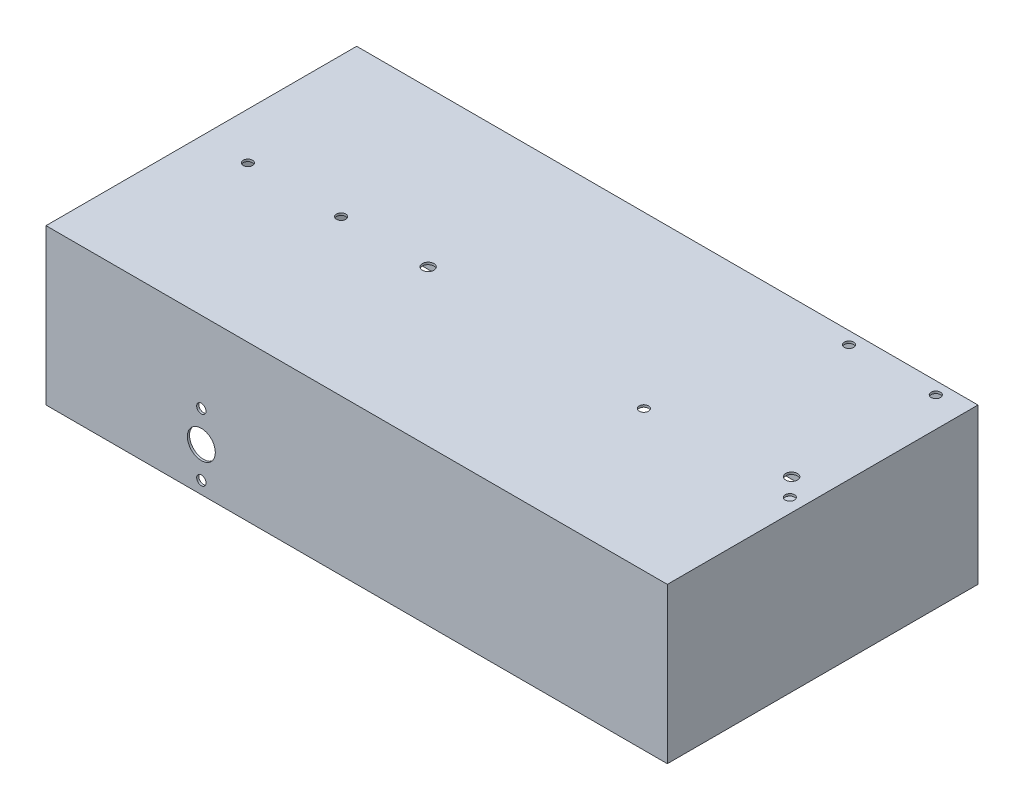
from build123d import *

# Parameters (mm, degrees)
SKETCH1_W           = 200
SKETCH1_H           = 100
BOSS_EXTRUDE1_DEPTH = 50
SKETCH3_W           = 198.6
SKETCH3_H           = 98.6
CUT_EXTRUDE1_DEPTH  = 49.3
SKETCH4_W           = 54.3
SKETCH4_H           = 98.6
BOSS_EXTRUDE2_DEPTH = 0.7
SKETCH2_R           = 4.5
SKETCH2_R_2         = 1.5
CUT_EXTRUDE2_DEPTH  = 230.128784748
SKETCH8_R           = 1.21
CUT_EXTRUDE6_DEPTH  = 1.8
SKETCH10_R          = 1.87
CUT_EXTRUDE8_DEPTH  = 0.7
SKETCH9_R           = 1.5
CUT_EXTRUDE7_DEPTH  = 213.132034356
SKETCH11_R          = 1.5
CUT_EXTRUDE9_DEPTH  = 0.7


with BuildPart() as part:
    # Sketch1 → Boss-Extrude1 (new body)
    with BuildSketch(Plane(origin=(0, 0, 0), x_dir=(1, 0, 0), z_dir=(0, 1, 0))):
        with Locations((100, 0)):
            Rectangle(SKETCH1_W, SKETCH1_H)
    extrude(amount=BOSS_EXTRUDE1_DEPTH)

    # Sketch3 → Cut-Extrude1 (cut)
    with BuildSketch(Plane.XZ):
        with Locations((100, 0)):
            Rectangle(SKETCH3_W, SKETCH3_H)
    extrude(amount=-CUT_EXTRUDE1_DEPTH, mode=Mode.SUBTRACT)

    # Sketch4 → Boss-Extrude2 (add)
    with BuildSketch(Plane.XZ):
        with Locations((172.15, 0)):
            Rectangle(SKETCH4_W, SKETCH4_H)
    extrude(amount=-BOSS_EXTRUDE2_DEPTH)

    # Sketch2 → Cut-Extrude2 (cut, through all)
    with BuildSketch(Plane.XY.offset(50)):
        with Locations((50, 14)):
            Circle(SKETCH2_R)
        with Locations((50, 4)):
            Circle(SKETCH2_R_2)
        with Locations((50, 24)):
            Circle(SKETCH2_R_2)
    extrude(amount=-CUT_EXTRUDE2_DEPTH, mode=Mode.SUBTRACT)

    # Sketch8 → Cut-Extrude6 (cut)
    with BuildSketch(Plane.XZ):
        with Locations(Location((160, 8.45, 0), (0, 0, 270))):
            Circle(SKETCH8_R)
        with Locations(Location((160, -7.05, 0), (0, 0, 270))):
            Circle(SKETCH8_R)
    extrude(amount=-CUT_EXTRUDE6_DEPTH, mode=Mode.SUBTRACT)

    # Sketch10 → Cut-Extrude8 (cut)
    with BuildSketch(Plane.XZ.offset(-49.3)):
        with Locations(Location((190, 0, 0), (0, 0, 270))):
            Circle(SKETCH10_R)
        with Locations(Location((73, 0, 0), (0, 0, 270))):
            Circle(SKETCH10_R)
    extrude(amount=-CUT_EXTRUDE8_DEPTH, mode=Mode.SUBTRACT)

    # Sketch9 → Cut-Extrude7 (cut, through all)
    with BuildSketch(Plane(origin=(0, 50, 0), x_dir=(1, 0, 0), z_dir=(0, 1, 0))):
        with Locations(Location((15, 0, 0), (0, 0, 270))):
            Circle(SKETCH9_R)
        with Locations(Location((45, 0, 0), (0, 0, 270))):
            Circle(SKETCH9_R)
    extrude(amount=-CUT_EXTRUDE7_DEPTH, mode=Mode.SUBTRACT)

    # Sketch11 → Cut-Extrude9 (cut)
    with BuildSketch(Plane(origin=(143.38, 50, -175.08), x_dir=(0, 0, 1), z_dir=(0, 1, 0))):
        with Locations((129.04, 47)):
            Circle(SKETCH11_R)
        with Locations((181.11, 52.08)):
            Circle(SKETCH11_R)
        with Locations((179.84, 3.82)):
            Circle(SKETCH11_R)
        with Locations((129.04, 19.06)):
            Circle(SKETCH11_R)
    extrude(amount=-CUT_EXTRUDE9_DEPTH, mode=Mode.SUBTRACT)


solid = part.part
